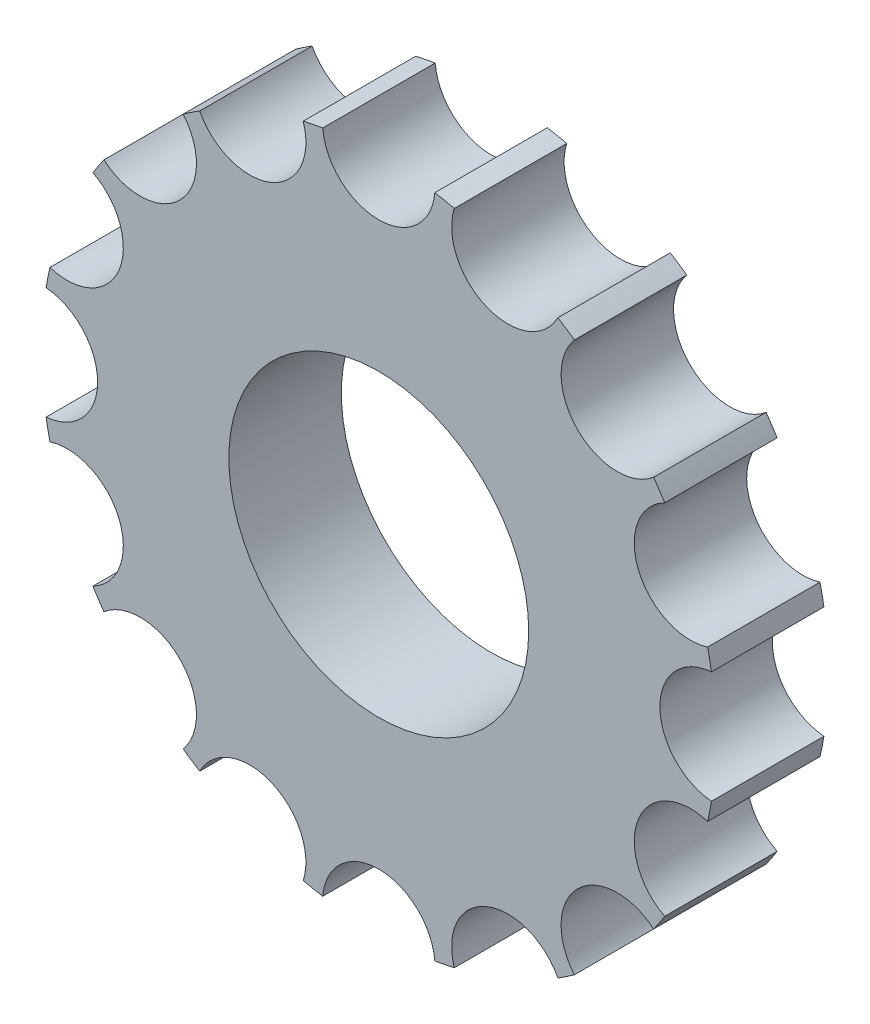
from build123d import *

# Parameters (mm, degrees)
SKETCH1_R           = 45
SKETCH1_R_2         = 20
BOSS_EXTRUDE1_DEPTH = 15
SKETCH2_R           = 7.5
CUT_EXTRUDE1_DEPTH  = 15


with BuildPart() as part:
    # Sketch1 → Boss-Extrude1 (new body)
    with BuildSketch(Plane.XY):
        Circle(SKETCH1_R)
        Circle(SKETCH1_R_2, mode=Mode.SUBTRACT)
    extrude(amount=BOSS_EXTRUDE1_DEPTH)

    # Sketch2 → Cut-Extrude1 (cut)
    with BuildSketch(Plane.XY.offset(15)):
        with Locations((0, 45)):
            Circle(SKETCH2_R)
        with Locations((17.220754456, 41.574578963)):
            Circle(SKETCH2_R)
        with Locations((31.819805153, 31.819805153)):
            Circle(SKETCH2_R)
        with Locations((41.574578963, 17.220754456)):
            Circle(SKETCH2_R)
        with Locations((45, 0)):
            Circle(SKETCH2_R)
        with Locations((41.574578963, -17.220754456)):
            Circle(SKETCH2_R)
        with Locations((31.819805153, -31.819805153)):
            Circle(SKETCH2_R)
        with Locations((17.220754456, -41.574578963)):
            Circle(SKETCH2_R)
        with Locations((0, -45)):
            Circle(SKETCH2_R)
        with Locations((-17.220754456, -41.574578963)):
            Circle(SKETCH2_R)
        with Locations((-31.819805153, -31.819805153)):
            Circle(SKETCH2_R)
        with Locations((-41.574578963, -17.220754456)):
            Circle(SKETCH2_R)
        with Locations((-45, 0)):
            Circle(SKETCH2_R)
        with Locations((-41.574578963, 17.220754456)):
            Circle(SKETCH2_R)
        with Locations((-31.819805153, 31.819805153)):
            Circle(SKETCH2_R)
        with Locations((-17.220754456, 41.574578963)):
            Circle(SKETCH2_R)
    extrude(amount=-CUT_EXTRUDE1_DEPTH, mode=Mode.SUBTRACT)


solid = part.part
